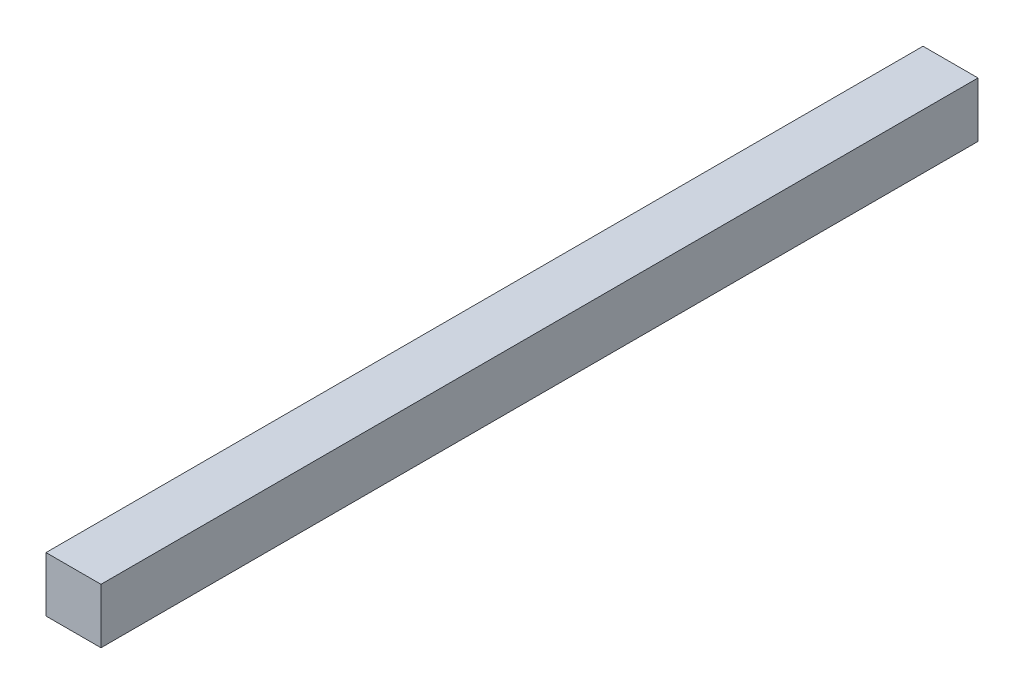
from build123d import *

# Parameters (mm, degrees)
SKETCH_1_W      = 20
SKETCH_1_H      = 20
EXTRUDE_1_DEPTH = 319


with BuildPart() as part:
    # 草图1 → 凸台-拉伸1 (new body)
    with BuildSketch(Plane.XY):
        with Locations((10, 10)):
            Rectangle(SKETCH_1_W, SKETCH_1_H)
    extrude(amount=EXTRUDE_1_DEPTH)


solid = part.part
